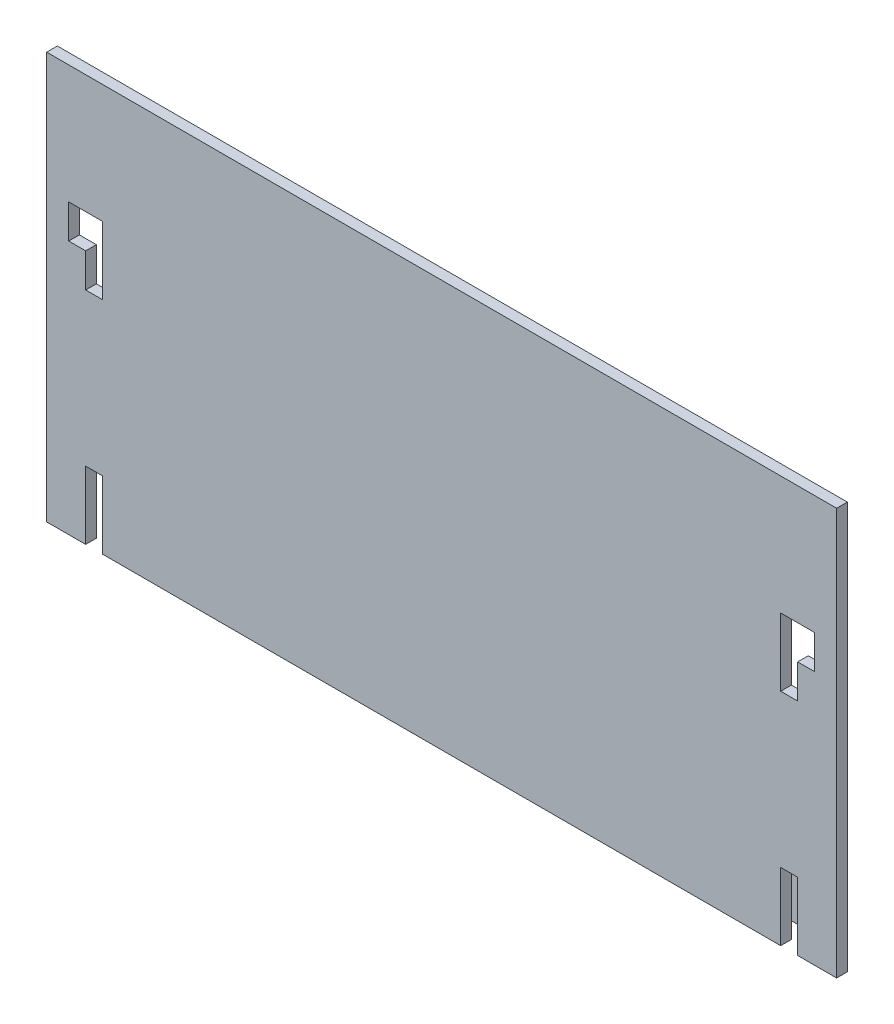
from build123d import *

# Parameters (mm, degrees)
BOSS_EXTRUDE1_DEPTH = 147.955
SKETCH2_W           = 10.4775
SKETCH2_H           = 19.05
CUT_EXTRUDE1_DEPTH  = 162.085115169
SKETCH3_W           = 3.175
SKETCH3_H           = 12.7
CUT_EXTRUDE2_DEPTH  = 162.085115169
SKETCH4_W           = 6.35
SKETCH4_H           = 6.35
SKETCH4_W_2         = 3.175
CUT_EXTRUDE3_DEPTH  = 162.085115169


with BuildPart() as part:
    # Sketch1 → Boss-Extrude1 (new body)
    with BuildSketch(Plane(origin=(0, 0, 0), x_dir=(0, 0, -1), z_dir=(1, 0, 0))):
        with BuildLine():
            Line((1.524, 0), (1.524, -12.7))
            Line((1.524, -12.7), (3.524, -12.7))
            Line((3.524, -12.7), (3.524, 3.175))
            Line((3.524, 3.175), (1.651, 3.175))
            ThreePointArc((1.651, 3.175), (-0.59406403, 4.10493597), (-1.524, 6.35))
            Line((-1.524, 6.35), (-1.524, 63.5))
            Line((-1.524, 63.5), (-3.524, 63.5))
            Line((-3.524, 63.5), (-3.524, -12.7))
            Line((-3.524, -12.7), (-1.524, -12.7))
            Line((-1.524, -12.7), (-1.524, 0))
            Line((-1.524, 0), (1.524, 0))
        make_face()
    extrude(amount=BOSS_EXTRUDE1_DEPTH)

    # Sketch2 → Cut-Extrude1 (cut, through all)
    with BuildSketch(Plane(origin=(0, 0, 1.524), x_dir=(-1, 0, 0), z_dir=(0, 0, -1))):
        with Locations((-142.71625, -3.175)):
            Rectangle(SKETCH2_W, SKETCH2_H)
        with Locations((-5.23875, -3.175)):
            Rectangle(SKETCH2_W, SKETCH2_H)
    extrude(amount=CUT_EXTRUDE1_DEPTH, mode=Mode.SUBTRACT)

    # Sketch3 → Cut-Extrude2 (cut, through all)
    with BuildSketch(Plane(origin=(0, 0, 1.524), x_dir=(-1, 0, 0), z_dir=(0, 0, -1))):
        with Locations((-139.065, -6.35)):
            Rectangle(SKETCH3_W, SKETCH3_H)
        with Locations((-8.89, -6.35)):
            Rectangle(SKETCH3_W, SKETCH3_H)
    extrude(amount=-CUT_EXTRUDE2_DEPTH, mode=Mode.SUBTRACT)

    # Sketch4 → Cut-Extrude3 (cut, through all)
    with BuildSketch(Plane(origin=(0, 0, 1.524), x_dir=(-1, 0, 0), z_dir=(0, 0, -1))):
        with Locations((-140.6525, 38.1)):
            Rectangle(SKETCH4_W, SKETCH4_H)
        with Locations((-139.065, 31.75)):
            Rectangle(SKETCH4_W_2, SKETCH4_H)
        Polygon((-10.4775, 41.275), (-10.4775, 34.925), (-7.3025, 34.925), (-4.1275, 34.925), (-4.1275, 41.275), align=None)
        with Locations((-8.89, 31.75)):
            Rectangle(SKETCH4_W_2, SKETCH4_H)
    extrude(amount=-CUT_EXTRUDE3_DEPTH, mode=Mode.SUBTRACT)


solid = part.part
